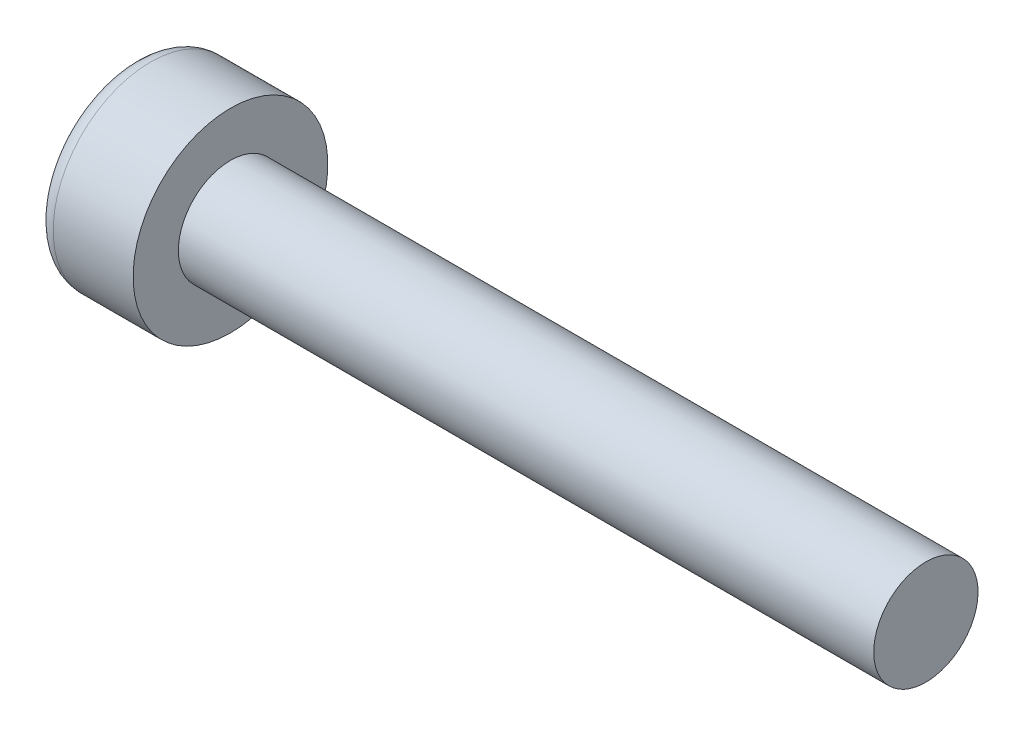
from build123d import *


with BuildPart() as part:
    # Sketch1 → Revolve1 (revolve)
    with BuildSketch(Plane.XY):
        with BuildLine():
            Line((0, 0), (20, 0))
            Line((20, 0), (20, -1.5))
            Line((20, -1.5), (-2.8, -1.5))
            Line((-2.8, -1.5), (-2.8, 0.8))
            ThreePointArc((-2.8, 0.8), (-2.653553391, 1.153553391), (-2.3, 1.3))
            Line((-2.3, 1.3), (0, 1.3))
            Line((0, 1.3), (0, 0))
        make_face()
    revolve(axis=Axis((20, -1.5, 0), (-1, 0, 0)))


solid = part.part
